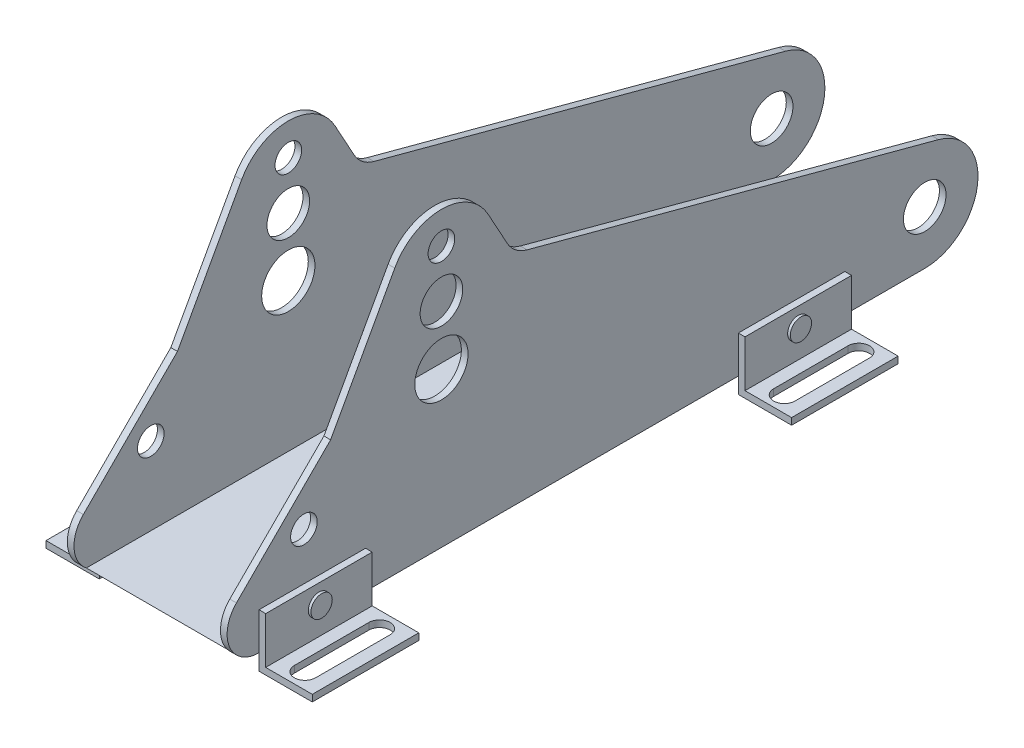
from build123d import *

# Parameters (mm, degrees)
DODANIE_WYCI_GNI_CIE1_DEPTH      = 30
DODANIE_WYCI_GNI_CIE1_DEPTH_BACK = 30
WYTNIJ_WYCI_GNI_CIE1_DEPTH       = 232.526456676
WYTNIJ_WYCI_GNI_CIE1_DEPTH_BACK  = 232.526456676
SZKIC2_W                         = 55
SZKIC2_H                         = 107.496477766
SZKIC3_W                         = 55
SZKIC3_H                         = 40
WYTNIJ_WYCI_GNI_CIE3_DEPTH       = 232.526456676
SZKIC4_W                         = 40
SZKIC4_H                         = 20
DODANIE_WYCI_GNI_CIE2_DEPTH      = 20
SZKIC5_W                         = 17.5
SZKIC5_H                         = 17.5
WYTNIJ_WYCI_GNI_CIE4_DEPTH       = 262.571382555
SZKIC6_R                         = 4
DODANIE_WYCI_GNI_CIE3_DEPTH      = 1
WYTNIJ_WYCI_GNI_CIE5_DEPTH       = 237.615194231
SZKIC8_R                         = 5
SZKIC8_R_2                       = 8
SZKIC8_R_3                       = 10
WYTNIJ_WYCI_GNI_CIE6_DEPTH       = 244.114171


with BuildPart() as part:
    # Szkic1 → Dodanie-wyciągnięcie1 (new, two sides: drawn at the far end of the back side and taken through both)
    with BuildSketch(Plane(origin=(0, 0, 0), x_dir=(0, 0, -1), z_dir=(1, 0, 0)).offset(-DODANIE_WYCI_GNI_CIE1_DEPTH_BACK)):
        with BuildLine():
            Line((0, 0), (181.505583399, 0))
            ThreePointArc((181.505583399, 0), (201.334480627, 17.389476156), (186.681964301, 39.318516526))
            Line((186.681964301, 39.318516526), (32.133832095, 80.729563742))
            ThreePointArc((32.133832095, 80.729563742), (27.839163279, 82.875338226), (24.730497196, 86.533852072))
            Line((24.730497196, 86.533852072), (17.525057128, 99.637031321))
            ThreePointArc((17.525057128, 99.637031321), (0, 110), (-17.525057128, 99.637031321))
            Line((-17.525057128, 99.637031321), (-41.617635429, 55.824388502))
            Line((-41.617635429, 55.824388502), (-76.972974488, 20.469049442))
            ThreePointArc((-76.972974488, 20.469049442), (-79.572186332, 7.401929091), (-68.494416601, 0))
            Line((-68.494416601, 0), (0, 0))
        make_face()
    extrude(amount=DODANIE_WYCI_GNI_CIE1_DEPTH + DODANIE_WYCI_GNI_CIE1_DEPTH_BACK)

    # Szkic2 → Wytnij-wyciągnięcie1 (cut, two sides: drawn at the far end of the back side and taken through both)
    with BuildSketch(Plane.XY.offset(-WYTNIJ_WYCI_GNI_CIE1_DEPTH_BACK)):
        with Locations((0, 56.251761117)):
            Rectangle(SZKIC2_W, SZKIC2_H)
    extrude(amount=WYTNIJ_WYCI_GNI_CIE1_DEPTH + WYTNIJ_WYCI_GNI_CIE1_DEPTH_BACK, mode=Mode.SUBTRACT)

    # Szkic3 → Wytnij-wyciągnięcie3 (cut, through all)
    with BuildSketch(Plane(origin=(0, 0, 0), x_dir=(1, 0, 0), z_dir=(0, 1, 0))):
        with Locations((0, 171.194405091)):
            Rectangle(SZKIC3_W, SZKIC3_H)
    extrude(amount=WYTNIJ_WYCI_GNI_CIE3_DEPTH, mode=Mode.SUBTRACT)

    # Szkic4 → Dodanie-wyciągnięcie2 (add)
    with BuildSketch(Plane(origin=(30, 0, 0), x_dir=(0, 0, -1), z_dir=(1, 0, 0))):
        with Locations((-48.494416601, 4)):
            Rectangle(SZKIC4_W, SZKIC4_H)
        with Locations((131.505583399, 4)):
            Rectangle(SZKIC4_W, SZKIC4_H)
    dodanie_wyci_gni_cie2 = extrude(amount=DODANIE_WYCI_GNI_CIE2_DEPTH)

    # Szkic5 → Wytnij-wyciągnięcie4 (cut, through all)
    with BuildSketch(Plane(origin=(0, 0, -151.505583399), x_dir=(-1, 0, 0), z_dir=(0, 0, -1))):
        with Locations((-41.25, 5.25)):
            Rectangle(SZKIC5_W, SZKIC5_H)
    wytnij_wyci_gni_cie4 = extrude(amount=-WYTNIJ_WYCI_GNI_CIE4_DEPTH, mode=Mode.SUBTRACT)

    # Szkic6 → Dodanie-wyciągnięcie3 (add)
    with BuildSketch(Plane(origin=(32.5, 0, 0), x_dir=(0, 0, -1), z_dir=(1, 0, 0))):
        with Locations((-48.494416601, 7)):
            Circle(SZKIC6_R)
        with Locations((131.505583399, 7)):
            Circle(SZKIC6_R)
    dodanie_wyci_gni_cie3 = extrude(amount=DODANIE_WYCI_GNI_CIE3_DEPTH)

    # Lustro2: Dodanie-wyciągnięcie2, Wytnij-wyciągnięcie4, Dodanie-wyciągnięcie3 across plane
    add(dodanie_wyci_gni_cie2.mirror(Plane(origin=(0, 0, 0), x_dir=(0, 0, 1), z_dir=(1, 0, 0))))
    add(wytnij_wyci_gni_cie4.mirror(Plane(origin=(0, 0, 0), x_dir=(0, 0, 1), z_dir=(1, 0, 0))), mode=Mode.SUBTRACT)
    add(dodanie_wyci_gni_cie3.mirror(Plane(origin=(0, 0, 0), x_dir=(0, 0, 1), z_dir=(1, 0, 0))))

    # Szkic7 → Wytnij-wyciągnięcie5 (cut, through all)
    with BuildSketch(Plane(origin=(0, -3.5, 0), x_dir=(1, 0, 0), z_dir=(0, 1, 0))):
        with BuildLine():
            Line((-37.25, 145.505583399), (-37.25, 117.505583399))
            ThreePointArc((-37.25, 117.505583399), (-41.25, 113.505583399), (-45.25, 117.505583399))
            Line((-45.25, 117.505583399), (-45.25, 145.505583399))
            ThreePointArc((-45.25, 145.505583399), (-41.25, 149.505583399), (-37.25, 145.505583399))
        make_face()
        with BuildLine():
            Line((-37.25, -34.494416601), (-37.25, -62.494416601))
            ThreePointArc((-37.25, -62.494416601), (-41.25, -66.494416601), (-45.25, -62.494416601))
            Line((-45.25, -62.494416601), (-45.25, -34.494416601))
            ThreePointArc((-45.25, -34.494416601), (-41.25, -30.494416601), (-37.25, -34.494416601))
        make_face()
    wytnij_wyci_gni_cie5 = extrude(amount=-WYTNIJ_WYCI_GNI_CIE5_DEPTH, mode=Mode.SUBTRACT)

    # Lustro3: Wytnij-wyciągnięcie5 across plane
    add(wytnij_wyci_gni_cie5.mirror(Plane(origin=(0, 0, 0), x_dir=(0, 0, 1), z_dir=(1, 0, 0))), mode=Mode.SUBTRACT)

    # Szkic8 → Wytnij-wyciągnięcie6 (cut, through all)
    with BuildSketch(Plane(origin=(30, 0, 0), x_dir=(0, 0, -1), z_dir=(1, 0, 0))):
        with Locations((0, 98)):
            Circle(SZKIC8_R)
        with Locations((-51.634860528, 31.718842875)):
            Circle(SZKIC8_R)
        with Locations((0, 80)):
            Circle(SZKIC8_R_2)
        with Locations((0, 58)):
            Circle(SZKIC8_R_3)
        with Locations((181.505583399, 20)):
            Circle(SZKIC8_R_2)
    extrude(amount=-WYTNIJ_WYCI_GNI_CIE6_DEPTH, mode=Mode.SUBTRACT)


solid = part.part
